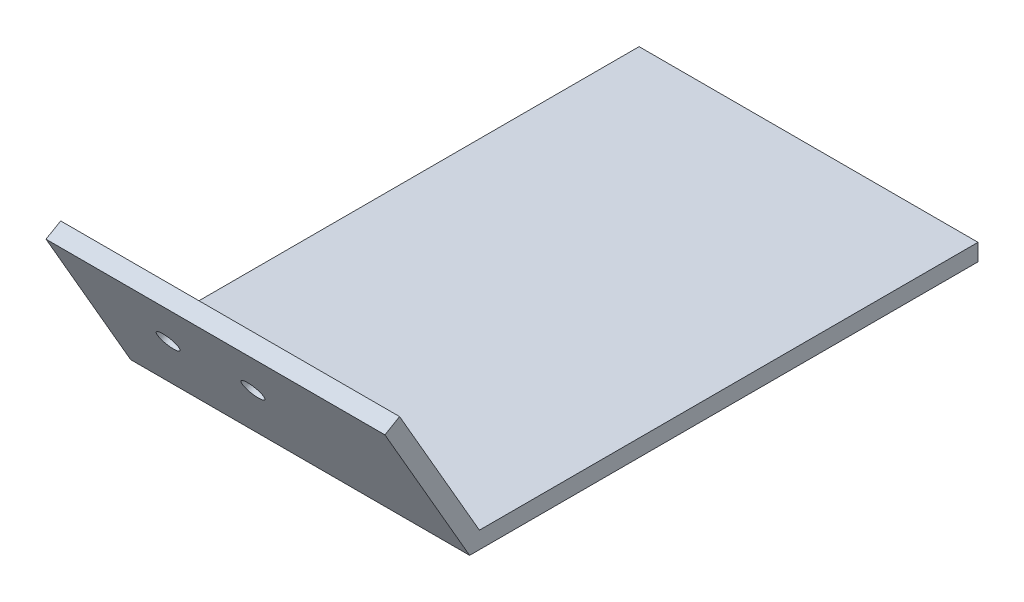
from build123d import *

# Parameters (mm, degrees)
BOSS_EXTRUDE1_DEPTH = 100
SKETCH2_R           = 3.175
CUT_EXTRUDE1_DEPTH  = 182.919520377


with BuildPart() as part:
    # Sketch1 → Boss-Extrude1 (new body)
    with BuildSketch(Plane(origin=(0, 0, 0), x_dir=(0, 0, -1), z_dir=(1, 0, 0))):
        Polygon((0, 0), (-25, 43.301270189), (-20.669872981, 45.801270189), (2.886751346, 5), (150, 5), (150, 0), align=None)
    extrude(amount=BOSS_EXTRUDE1_DEPTH)

    # Sketch2 → Cut-Extrude1 (cut, through all)
    with BuildSketch(Plane(origin=(0, 2.5, -4.330127019), x_dir=(-1, 0, 0), z_dir=(0, 0.49999999999999806, -0.8660254037844397))):
        with Locations(Location((-50, 27.886751346, 0), (0, 0, 90))):
            Circle(SKETCH2_R)
        with Locations(Location((-25, 27.886751346, 0), (0, 0, 90))):
            Circle(SKETCH2_R)
    extrude(amount=-CUT_EXTRUDE1_DEPTH, mode=Mode.SUBTRACT)


solid = part.part
